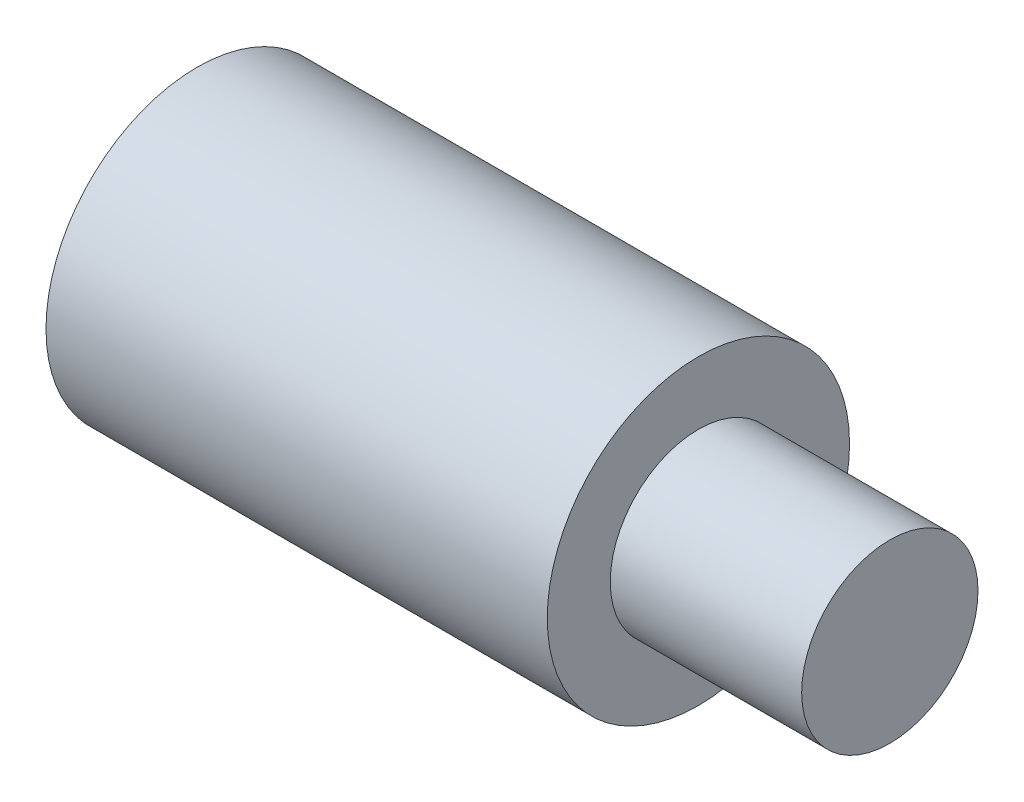
from build123d import *

# Parameters (mm, degrees)
SOCKET_SKETCH_W = 13.7
SOCKET_SKETCH_H = 1.5875


with BuildPart() as part:
    # Conn_T2_ORB2 Sketch → Conn_T2_ORB2 (revolve)
    with BuildSketch(Plane.XY):
        Polygon((7.6, 0), (7.6, 3.5), (0, 3.5), (0, 6), (-19.9, 6), (-19.9, 0), align=None)
    revolve(axis=Axis((-300, 0, 0), (1, 0, 0)))

    # Socket Sketch → Socket (revolve, cut)
    with BuildSketch(Plane.XY):
        with Locations((-14.05, 0.79375)):
            Rectangle(SOCKET_SKETCH_W, SOCKET_SKETCH_H)
    revolve(axis=Axis((-300, 0, 0), (1, 0, 0)), mode=Mode.SUBTRACT)


solid = part.part
